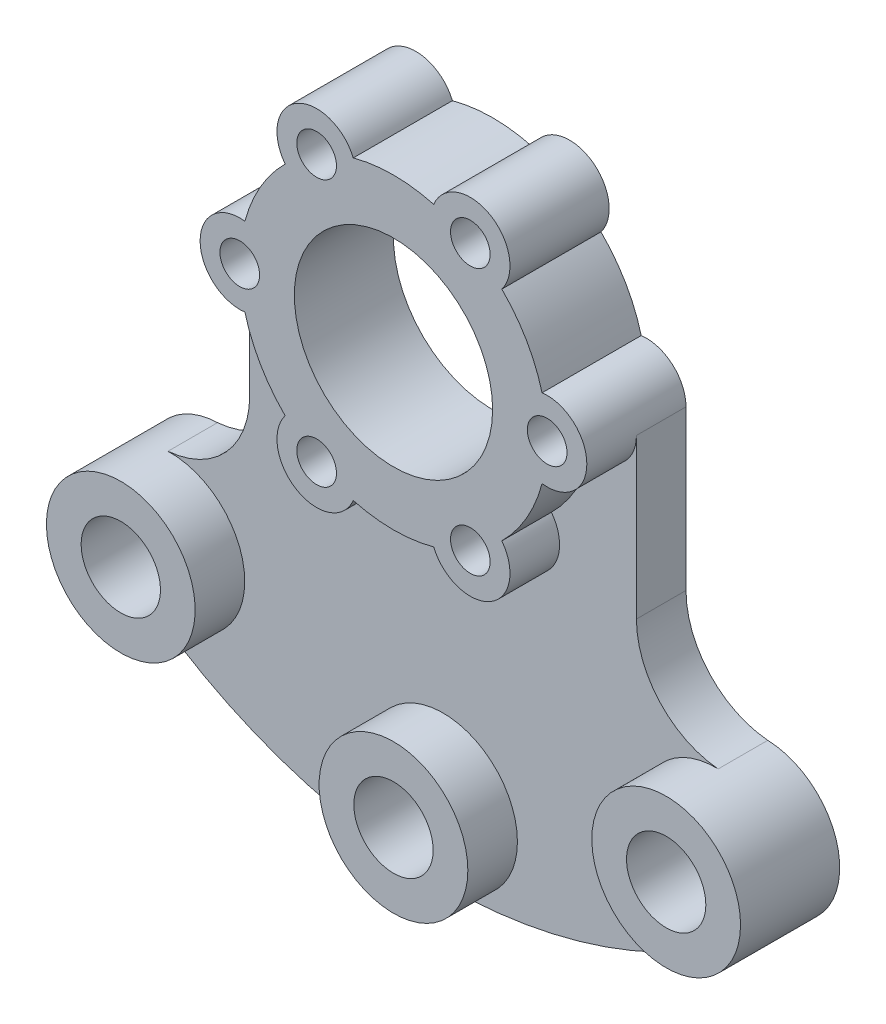
from build123d import *

# Parameters (mm, degrees)
CROQUIS1_R                = 15
CROQUIS1_R_2              = 8
SALIENTE_EXTRUIR1_DEPTH   = 20
SALIENTE_EXTRUIR1_2_DEPTH = 20
SALIENTE_EXTRUIR1_3_DEPTH = 20
CROQUIS1_R_3              = 20
CROQUIS1_R_4              = 4
SALIENTE_EXTRUIR1_4_DEPTH = 20
SALIENTE_EXTRUIR2_DEPTH   = 10
CORTAR_EXTRUIR1_START     = -10
CROQUIS3_R                = 8
CORTAR_EXTRUIR1_DEPTH     = 10


with BuildPart() as part:
    # Croquis1 → Saliente-Extruir1 (new body)
    with BuildSketch(Plane.XY):
        with Locations((0, -82.97)):
            Circle(CROQUIS1_R)
        with Locations((0, -82.97)):
            Circle(CROQUIS1_R_2, mode=Mode.SUBTRACT)
    extrude(amount=SALIENTE_EXTRUIR1_DEPTH)



with BuildPart() as body_2:
    # Croquis1 → Saliente-Extruir1 2 (new body)
    with BuildSketch(Plane.XY):
        with Locations((55, -65)):
            Circle(CROQUIS1_R)
        with Locations((55, -65)):
            Circle(CROQUIS1_R_2, mode=Mode.SUBTRACT)
    extrude(amount=SALIENTE_EXTRUIR1_2_DEPTH)


with BuildPart() as body_3:
    # Croquis1 → Saliente-Extruir1 3 (new body)
    with BuildSketch(Plane.XY):
        with Locations(Location((-55, -65, 0), (0, 0, 180))):
            Circle(CROQUIS1_R)
        with Locations(Location((-55, -65, 0), (0, 0, 180))):
            Circle(CROQUIS1_R_2, mode=Mode.SUBTRACT)
    extrude(amount=SALIENTE_EXTRUIR1_3_DEPTH)


with BuildPart() as body_4:
    # Croquis1 → Saliente-Extruir1 4 (new body)
    with BuildSketch(Plane.XY):
        with BuildLine():
            ThreePointArc((-21.854157167, 21.986264223), (-26.846787517, 15.5), (-29.967741935, 7.933123174))
            ThreePointArc((-29.967741935, 7.933123174), (-39, 0), (-29.967741935, -7.933123174))
            ThreePointArc((-29.967741935, -7.933123174), (-26.846787517, -15.5), (-21.854157167, -21.986264223))
            ThreePointArc((-21.854157167, -21.986264223), (-19.5, -33.774990748), (-8.113584768, -29.919387397))
            ThreePointArc((-8.113584768, -29.919387397), (0, -31), (8.113584768, -29.919387397))
            ThreePointArc((8.113584768, -29.919387397), (19.5, -33.774990748), (21.854157167, -21.986264223))
            ThreePointArc((21.854157167, -21.986264223), (26.846787517, -15.5), (29.967741935, -7.933123174))
            ThreePointArc((29.967741935, -7.933123174), (39, 0), (29.967741935, 7.933123174))
            ThreePointArc((29.967741935, 7.933123174), (26.846787517, 15.5), (21.854157167, 21.986264223))
            ThreePointArc((21.854157167, 21.986264223), (19.5, 33.774990748), (8.113584768, 29.919387397))
            ThreePointArc((8.113584768, 29.919387397), (0, 31), (-8.113584768, 29.919387397))
            ThreePointArc((-8.113584768, 29.919387397), (-19.5, 33.774990748), (-21.854157167, 21.986264223))
        make_face()
        Circle(CROQUIS1_R_3, mode=Mode.SUBTRACT)
        with Locations((31, 0)):
            Circle(CROQUIS1_R_4, mode=Mode.SUBTRACT)
        with Locations((15.5, -26.846787517)):
            Circle(CROQUIS1_R_4, mode=Mode.SUBTRACT)
        with Locations((-15.5, -26.846787517)):
            Circle(CROQUIS1_R_4, mode=Mode.SUBTRACT)
        with Locations((-31, 0)):
            Circle(CROQUIS1_R_4, mode=Mode.SUBTRACT)
        with Locations((-15.5, 26.846787517)):
            Circle(CROQUIS1_R_4, mode=Mode.SUBTRACT)
        with Locations((15.5, 26.846787517)):
            Circle(CROQUIS1_R_4, mode=Mode.SUBTRACT)
    extrude(amount=SALIENTE_EXTRUIR1_4_DEPTH)


with BuildPart() as part_1:
    add(part.part)

    add(body_2.part)  # Saliente-Extruir2 merges body 2

    add(body_3.part)  # Saliente-Extruir2 merges body 3

    add(body_4.part)  # Saliente-Extruir2 merges body 4
    # Croquis2 → Saliente-Extruir2 (add)
    with BuildSketch(Plane.XY):
        with BuildLine():
            Line((-39, 0), (-39, -32.071476789))
            ThreePointArc((-39, -32.071476789), (-44.036846437, -44.559737265), (-56.328516633, -50.058947709))
            ThreePointArc((-56.328516633, -50.058947709), (-69.988497958, -64.412693478), (-57.493543192, -79.791289408))
            ThreePointArc((-57.493543192, -79.791289408), (0, -97.97141107), (57.493543192, -79.791289408))
            ThreePointArc((57.493543192, -79.791289408), (69.988497958, -64.412693478), (56.328516633, -50.058947709))
            ThreePointArc((56.328516633, -50.058947709), (44.036846437, -44.559737265), (39, -32.071476789))
            Line((39, -32.071476789), (39, 0))
            ThreePointArc((39, 0), (36.279296141, -6.01074307), (29.967741935, -7.933123174))
            ThreePointArc((29.967741935, -7.933123174), (26.846787517, -15.5), (21.854157167, -21.986264223))
            ThreePointArc((21.854157167, -21.986264223), (19.5, -33.774990748), (8.113584768, -29.919387397))
            ThreePointArc((8.113584768, -29.919387397), (0, -31), (-8.113584768, -29.919387397))
            ThreePointArc((-8.113584768, -29.919387397), (-19.5, -33.774990748), (-21.854157167, -21.986264223))
            ThreePointArc((-21.854157167, -21.986264223), (-26.846787517, -15.5), (-29.967741935, -7.933123174))
            ThreePointArc((-29.967741935, -7.933123174), (-36.27929614, -6.01074307), (-39, 0))
        make_face()
    extrude(amount=SALIENTE_EXTRUIR2_DEPTH)

    # Croquis3 → Cortar-Extruir1 (cut)
    with BuildSketch(Plane.XY.offset(10).offset(CORTAR_EXTRUIR1_START)):
        with Locations(Location((-55, -65, 0), (0, 0, 180))):
            Circle(CROQUIS3_R)
        with Locations((0, -82.97)):
            Circle(CROQUIS3_R)
        with Locations((55, -65)):
            Circle(CROQUIS3_R)
    extrude(amount=CORTAR_EXTRUIR1_DEPTH, mode=Mode.SUBTRACT)


solid = part_1.part
